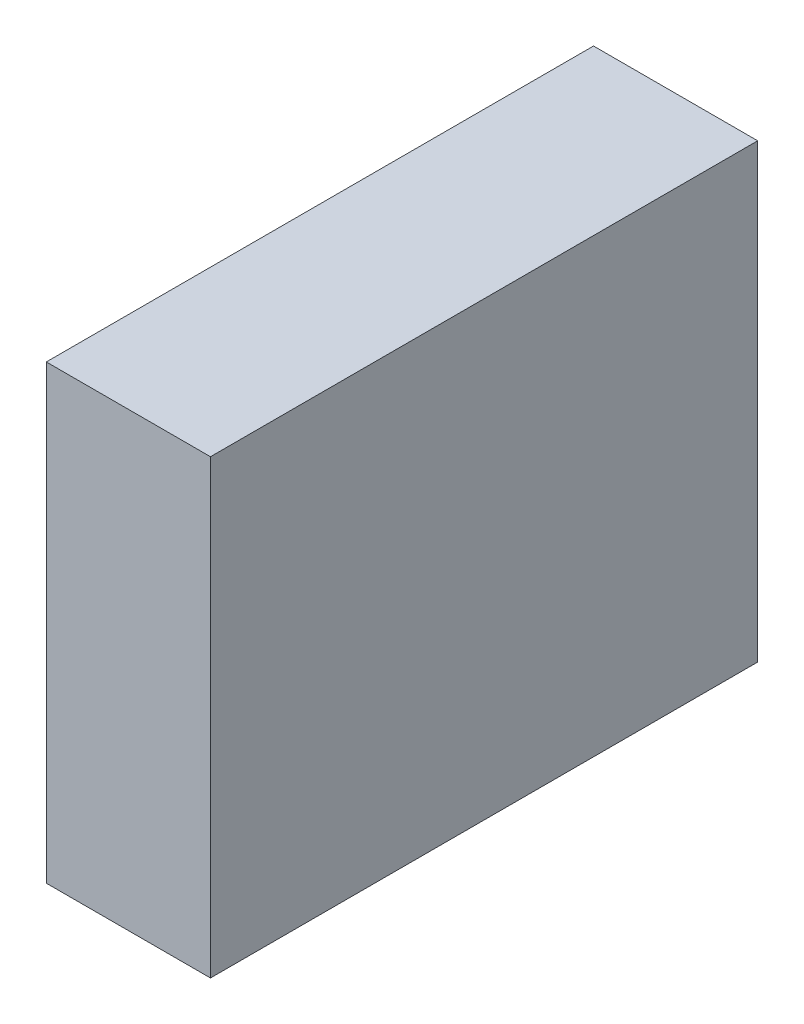
from build123d import *

# Parameters (mm, degrees)
SKETCH1_W           = 38.1
SKETCH1_H           = 127
BOSS_EXTRUDE1_DEPTH = 104.775


with BuildPart() as part:
    # Sketch1 → Boss-Extrude1 (new body)
    with BuildSketch(Plane(origin=(0, 0, 0), x_dir=(1, 0, 0), z_dir=(0, 1, 0))):
        with Locations((19.05, 63.5)):
            Rectangle(SKETCH1_W, SKETCH1_H)
    extrude(amount=BOSS_EXTRUDE1_DEPTH)


solid = part.part
